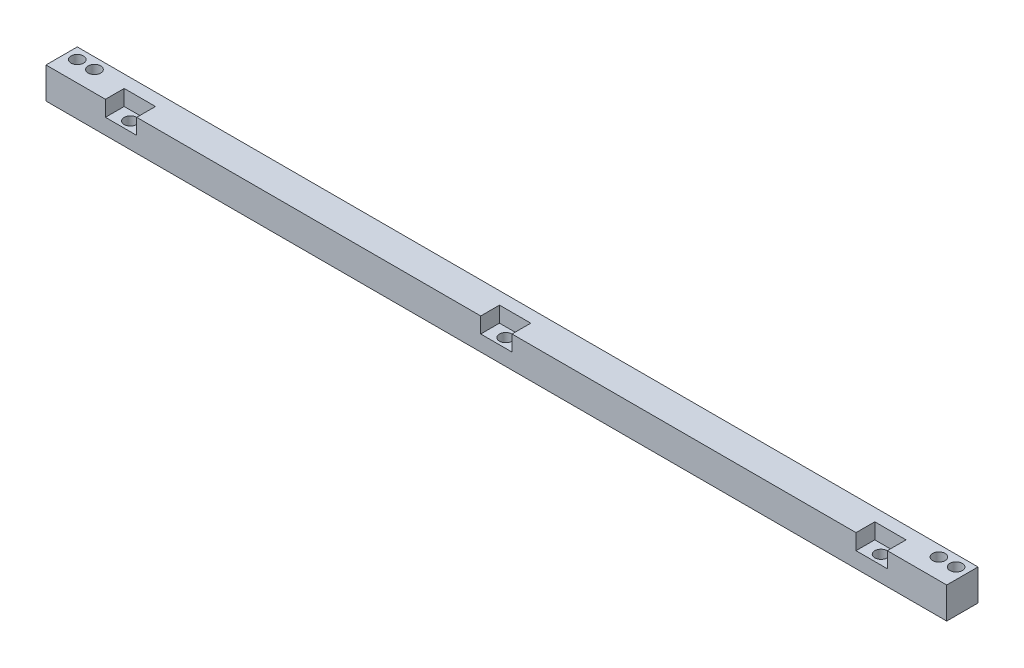
from build123d import *

# Parameters (mm, degrees)
SKETCH1_W           = 731.52
SKETCH1_H           = 25.4
BOSS_EXTRUDE1_DEPTH = 25.4
SKETCH2_R           = 5.08
CUT_EXTRUDE1_DEPTH  = 27.94
SKETCH3_W           = 25.4
SKETCH3_H           = 15.24
CUT_EXTRUDE2_DEPTH  = 12.7
SKETCH4_R           = 5.08
CUT_EXTRUDE3_DEPTH  = 15.24


with BuildPart() as part:
    # Sketch1 → Boss-Extrude1 (new body)
    with BuildSketch(Plane(origin=(0, 0, 0), x_dir=(1, 0, 0), z_dir=(0, 1, 0))):
        with Locations((365.76, 12.7)):
            Rectangle(SKETCH1_W, SKETCH1_H)
    extrude(amount=BOSS_EXTRUDE1_DEPTH)

    # Sketch2 → Cut-Extrude1 (cut)
    with BuildSketch(Plane(origin=(0, 25.4, 0), x_dir=(1, 0, 0), z_dir=(0, 1, 0))):
        with Locations(Location((8.89, 16.51, 0), (0, 0, 270))):
            Circle(SKETCH2_R)
        with Locations(Location((22.86, 16.51, 0), (0, 0, 270))):
            Circle(SKETCH2_R)
        with Locations(Location((722.63, 16.51, 0), (0, 0, 270))):
            Circle(SKETCH2_R)
        with Locations(Location((708.66, 16.51, 0), (0, 0, 270))):
            Circle(SKETCH2_R)
    extrude(amount=-CUT_EXTRUDE1_DEPTH, mode=Mode.SUBTRACT)

    # Sketch3 → Cut-Extrude2 (cut)
    with BuildSketch(Plane(origin=(0, 25.4, 0), x_dir=(1, 0, 0), z_dir=(0, 1, 0))):
        with Locations((60.96, 7.62)):
            Rectangle(SKETCH3_W, SKETCH3_H)
        with Locations((670.56, 7.62)):
            Rectangle(SKETCH3_W, SKETCH3_H)
        with Locations((365.76, 7.62)):
            Rectangle(SKETCH3_W, SKETCH3_H)
    extrude(amount=-CUT_EXTRUDE2_DEPTH, mode=Mode.SUBTRACT)

    # Sketch4 → Cut-Extrude3 (cut)
    with BuildSketch(Plane(origin=(0, 12.7, 0), x_dir=(1, 0, 0), z_dir=(0, 1, 0))):
        with Locations(Location((60.96, 7.62, 0), (0, 0, 270))):
            Circle(SKETCH4_R)
        with Locations(Location((670.56, 7.62, 0), (0, 0, 270))):
            Circle(SKETCH4_R)
        with Locations(Location((365.76, 7.62, 0), (0, 0, 270))):
            Circle(SKETCH4_R)
    extrude(amount=-CUT_EXTRUDE3_DEPTH, mode=Mode.SUBTRACT)


solid = part.part
